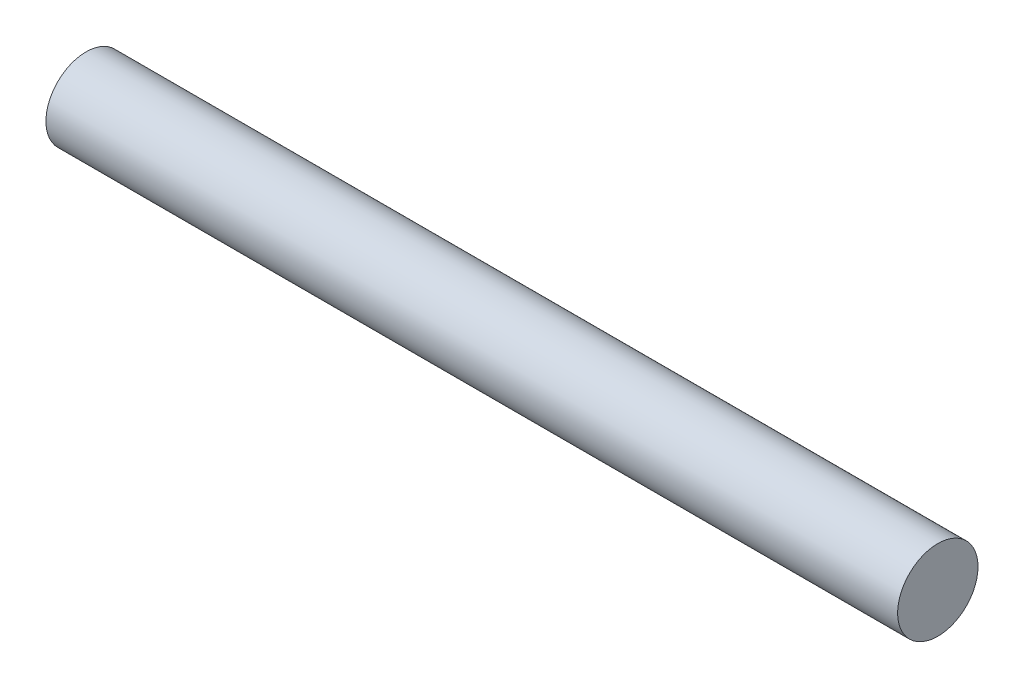
from build123d import *

# Parameters (mm, degrees)
SKETCH1_R           = 2.5
BOSS_EXTRUDE1_DEPTH = 53


with BuildPart() as part:
    # Sketch1 → Boss-Extrude1 (new body)
    with BuildSketch(Plane(origin=(0, 0, 0), x_dir=(0, 0, -1), z_dir=(1, 0, 0))):
        Circle(SKETCH1_R)
    extrude(amount=BOSS_EXTRUDE1_DEPTH)


solid = part.part
